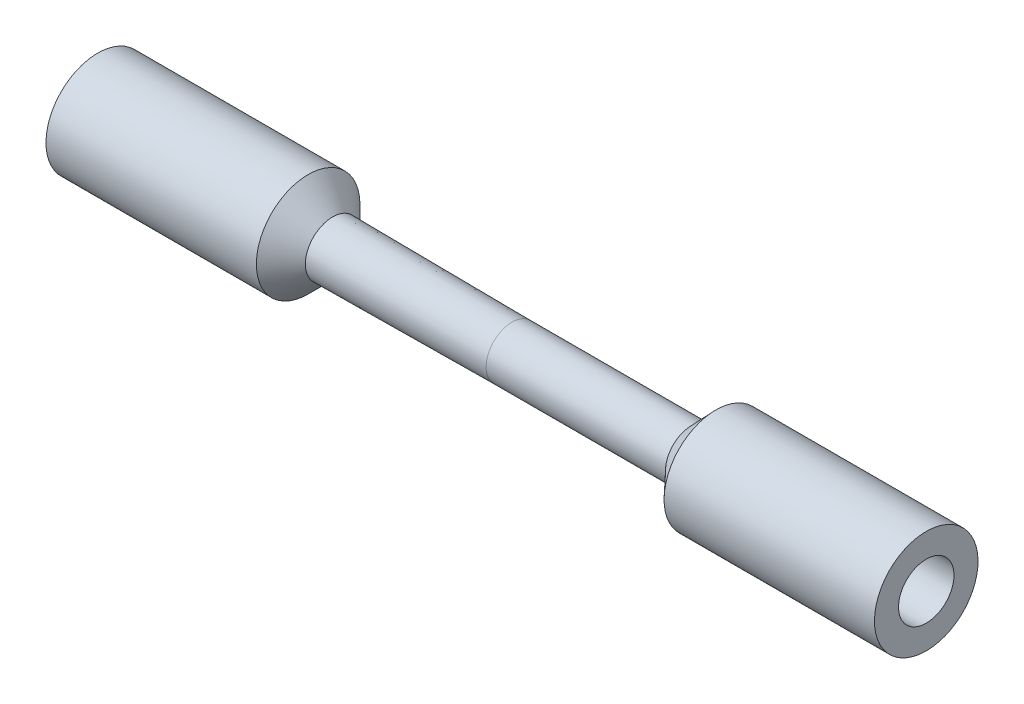
from build123d import *


with BuildPart() as part:
    # Sketch1 → Revolve1 (revolve)
    with BuildSketch(Plane.XY):
        Polygon((25.4, 1.5875), (14.400348017, 1.499999985), (12.900348032, 0), (0, 0), (0, 3.175), (50.8, 3.175), (50.8, 0), (37.899651968, 0), (36.4, 1.5875), align=None)
    revolve(axis=Axis((0, 3.175, 0), (1, 0, 0)))

    # Sketch6 → M3 Clearance Hole1 (revolve, cut)
    with BuildSketch(Plane.ZX.offset(3.175)):
        Polygon((0, 0), (0, 7.371463052), (1.7, 6.35), (1.7, 0), align=None)
    m3_clearance_hole1 = revolve(axis=Axis((-6.35, 3.175, 0), (1, 0, 0)), mode=Mode.SUBTRACT)

    # Mirror1: M3 Clearance Hole1 across plane
    add(m3_clearance_hole1.mirror(Plane.ZY.offset(-25.4)), mode=Mode.SUBTRACT)


solid = part.part
